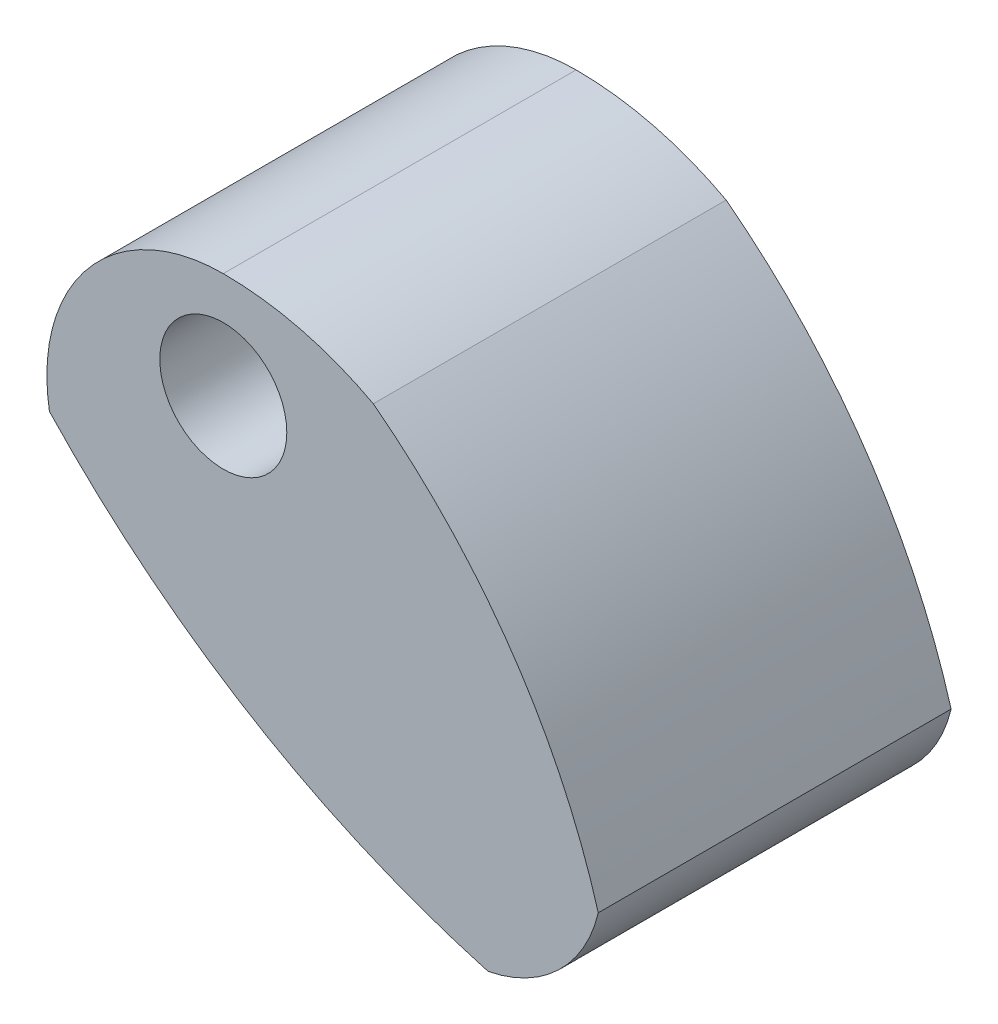
from build123d import *

# Parameters (mm, degrees)
BOSS_EXTRUDE3_DEPTH      = 10
M3_CLEARANCE_HOLE1_D     = 3.6
M3_CLEARANCE_HOLE1_DEPTH = 5
M3_CLEARANCE_HOLE1_TIP   = 1.081549114


with BuildPart() as part:
    # Sketch3 → Boss-Extrude3 (new body)
    with BuildSketch(Plane.XY):
        with BuildLine():
            ThreePointArc((10.627637959, -5.374147741), (8.187588203, -0.208463055), (4.251688797, 3.93241088))
            ThreePointArc((4.251688797, 3.93241088), (2.191837366, 4.729023368), (0, 5))
            ThreePointArc((0, 5), (-3.823420235, 3.222026956), (-4.927665225, -0.847416917))
            ThreePointArc((-4.927665225, -0.847416917), (0.77252532, -5.462986054), (7.504596942, -8.374147741))
            ThreePointArc((7.504596942, -8.374147741), (9.507210052, -7.33333117), (10.627637959, -5.374147741))
        make_face()
    extrude(amount=BOSS_EXTRUDE3_DEPTH)

    # M3 Clearance Hole1
    with Locations(Plane.XY.offset(10)):
        with Locations((0, 2)):
            Hole(M3_CLEARANCE_HOLE1_D / 2, depth=M3_CLEARANCE_HOLE1_DEPTH)
            with Locations((0, 0, -(M3_CLEARANCE_HOLE1_DEPTH + M3_CLEARANCE_HOLE1_TIP / 2))):  # 118° drill point
                Cone(0, M3_CLEARANCE_HOLE1_D / 2, M3_CLEARANCE_HOLE1_TIP, mode=Mode.SUBTRACT)


solid = part.part
